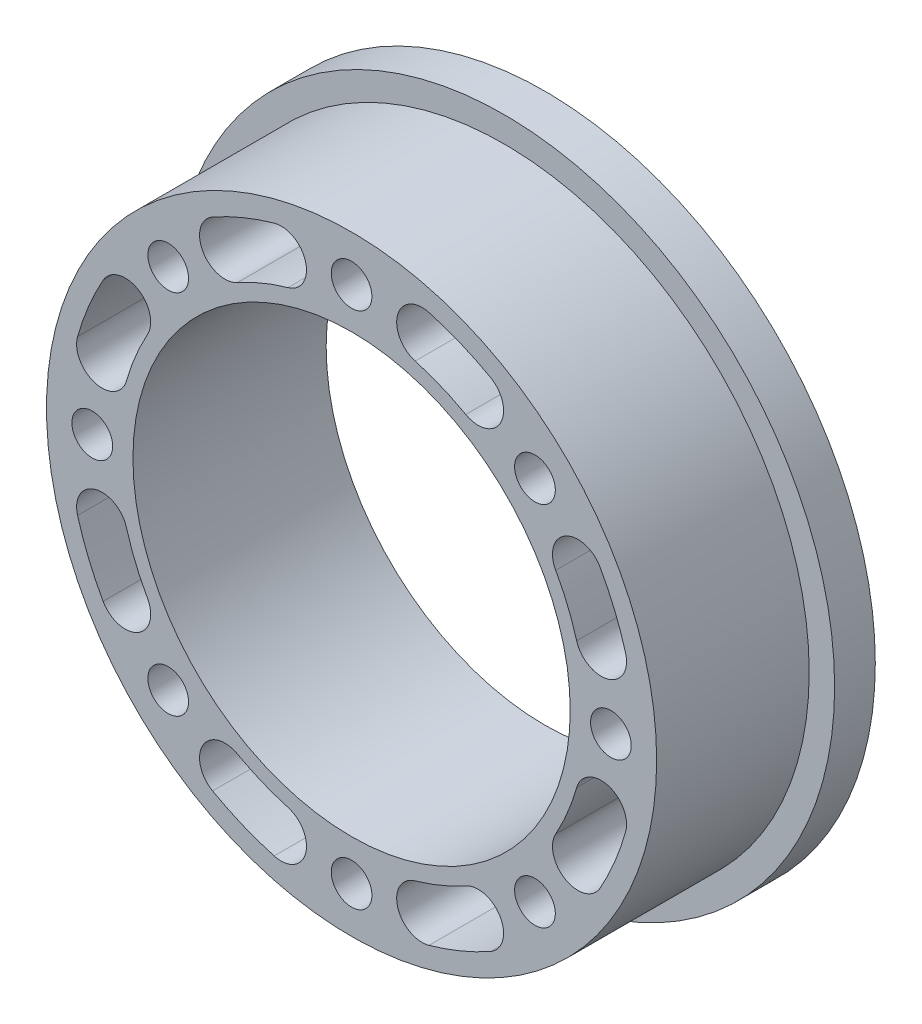
from build123d import *

# Parameters (mm, degrees)
SKETCH_1_R          = 32.5
SKETCH_1_R_2        = 21.5
EXTRUDE_1_DEPTH     = 4
SKETCH_2_R          = 30
SKETCH_2_R_2        = 21.5
EXTRUDE_2_DEPTH     = 15
SKETCH_3_R          = 2
CUT_EXTRUDE_1_DEPTH = 50.734294003


with BuildPart() as part:
    # 草图1 → 凸台-拉伸1 (new body)
    with BuildSketch(Plane.XY):
        Circle(SKETCH_1_R)
        Circle(SKETCH_1_R_2, mode=Mode.SUBTRACT)
    extrude(amount=EXTRUDE_1_DEPTH)

    # 草图2 → 凸台-拉伸2 (add)
    with BuildSketch(Plane.XY.offset(4)):
        Circle(SKETCH_2_R)
        Circle(SKETCH_2_R_2, mode=Mode.SUBTRACT)
    extrude(amount=EXTRUDE_2_DEPTH)

    # 草图3 → 切除-拉伸1 (cut, through all)
    with BuildSketch(Plane(origin=(0, 0, 0), x_dir=(-1, 0, 0), z_dir=(0, 0, -1))):
        with Locations((18.03122292, 18.03122292)):
            Circle(SKETCH_3_R)
        with Locations((25.5, 0)):
            Circle(SKETCH_3_R)
        with Locations((18.03122292, -18.03122292)):
            Circle(SKETCH_3_R)
        with Locations((0, -25.5)):
            Circle(SKETCH_3_R)
        with Locations((-18.03122292, -18.03122292)):
            Circle(SKETCH_3_R)
        with Locations((-25.5, 0)):
            Circle(SKETCH_3_R)
        with Locations((-18.03122292, 18.03122292)):
            Circle(SKETCH_3_R)
        with Locations((0, 25.5)):
            Circle(SKETCH_3_R)
        with BuildLine():
            ThreePointArc((7.613529763, 26.945021146), (10.715136106, 25.86862691), (13.669428647, 24.436585696))
            ThreePointArc((13.669428647, 24.436585696), (14.630781955, 21.034262987), (11.228459246, 20.072909679))
            ThreePointArc((11.228459246, 20.072909679), (8.801718944, 21.249229248), (6.253970877, 22.133410227))
            ThreePointArc((6.253970877, 22.133410227), (4.527944861, 25.218995129), (7.613529763, 26.945021146))
        make_face()
        with BuildLine():
            ThreePointArc((24.436585696, 13.669428647), (21.034262987, 14.630781955), (20.072909679, 11.228459246))
            ThreePointArc((20.072909679, 11.228459246), (21.249229248, 8.801718944), (22.133410227, 6.253970877))
            ThreePointArc((22.133410227, 6.253970877), (25.218995129, 4.527944861), (26.945021146, 7.613529763))
            ThreePointArc((26.945021146, 7.613529763), (25.86862691, 10.715136106), (24.436585696, 13.669428647))
        make_face()
        with BuildLine():
            ThreePointArc((26.945021146, -7.613529763), (25.218995129, -4.527944861), (22.133410227, -6.253970877))
            ThreePointArc((22.133410227, -6.253970877), (21.249229248, -8.801718944), (20.072909679, -11.228459246))
            ThreePointArc((20.072909679, -11.228459246), (21.034262987, -14.630781955), (24.436585696, -13.669428647))
            ThreePointArc((24.436585696, -13.669428647), (25.86862691, -10.715136106), (26.945021146, -7.613529763))
        make_face()
        with BuildLine():
            ThreePointArc((13.669428647, -24.436585696), (14.630781955, -21.034262987), (11.228459246, -20.072909679))
            ThreePointArc((11.228459246, -20.072909679), (8.801718944, -21.249229248), (6.253970877, -22.133410227))
            ThreePointArc((6.253970877, -22.133410227), (4.527944861, -25.218995129), (7.613529763, -26.945021146))
            ThreePointArc((7.613529763, -26.945021146), (10.715136106, -25.86862691), (13.669428647, -24.436585696))
        make_face()
        with BuildLine():
            ThreePointArc((-7.613529763, -26.945021146), (-4.527944861, -25.218995129), (-6.253970877, -22.133410227))
            ThreePointArc((-6.253970877, -22.133410227), (-8.801718944, -21.249229248), (-11.228459246, -20.072909679))
            ThreePointArc((-11.228459246, -20.072909679), (-14.630781955, -21.034262987), (-13.669428647, -24.436585696))
            ThreePointArc((-13.669428647, -24.436585696), (-10.715136106, -25.86862691), (-7.613529763, -26.945021146))
        make_face()
        with BuildLine():
            ThreePointArc((-24.436585696, -13.669428647), (-21.034262987, -14.630781955), (-20.072909679, -11.228459246))
            ThreePointArc((-20.072909679, -11.228459246), (-21.249229248, -8.801718944), (-22.133410227, -6.253970877))
            ThreePointArc((-22.133410227, -6.253970877), (-25.218995129, -4.527944861), (-26.945021146, -7.613529763))
            ThreePointArc((-26.945021146, -7.613529763), (-25.86862691, -10.715136106), (-24.436585696, -13.669428647))
        make_face()
        with BuildLine():
            ThreePointArc((-26.945021146, 7.613529763), (-25.218995129, 4.527944861), (-22.133410227, 6.253970877))
            ThreePointArc((-22.133410227, 6.253970877), (-21.249229248, 8.801718944), (-20.072909679, 11.228459246))
            ThreePointArc((-20.072909679, 11.228459246), (-21.034262987, 14.630781955), (-24.436585696, 13.669428647))
            ThreePointArc((-24.436585696, 13.669428647), (-25.86862691, 10.715136106), (-26.945021146, 7.613529763))
        make_face()
        with BuildLine():
            ThreePointArc((-13.669428647, 24.436585696), (-14.630781955, 21.034262987), (-11.228459246, 20.072909679))
            ThreePointArc((-11.228459246, 20.072909679), (-8.801718944, 21.249229248), (-6.253970877, 22.133410227))
            ThreePointArc((-6.253970877, 22.133410227), (-4.527944861, 25.218995129), (-7.613529763, 26.945021146))
            ThreePointArc((-7.613529763, 26.945021146), (-10.715136106, 25.86862691), (-13.669428647, 24.436585696))
        make_face()
    extrude(amount=-CUT_EXTRUDE_1_DEPTH, mode=Mode.SUBTRACT)


solid = part.part
